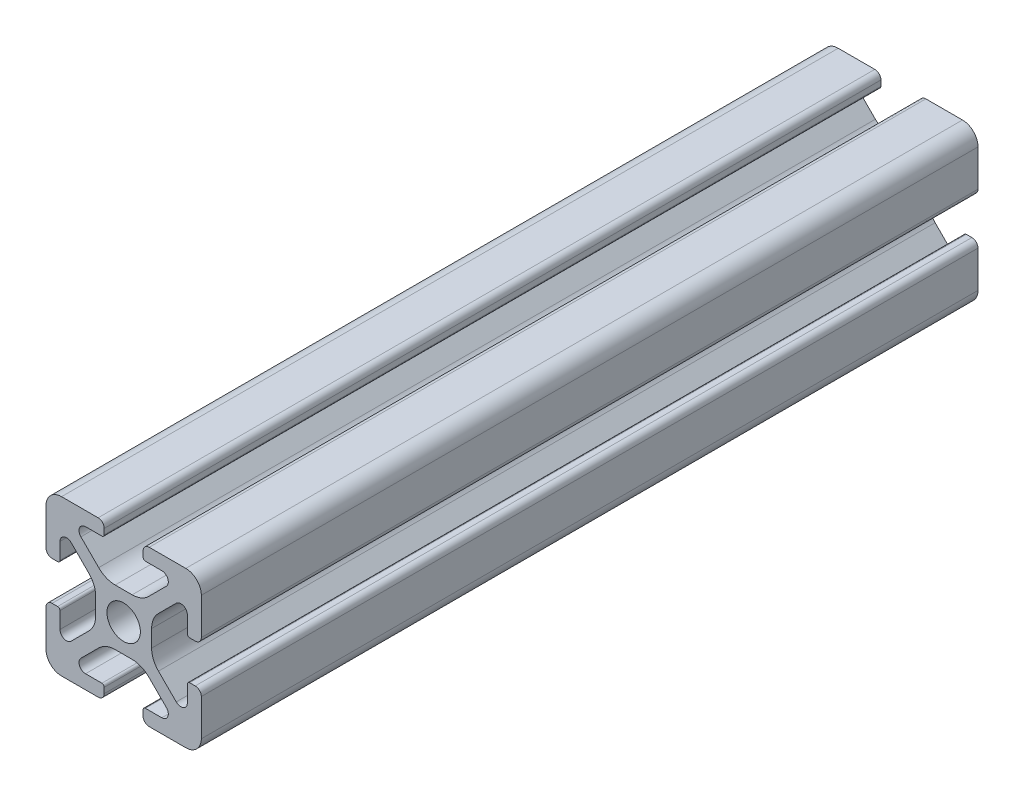
from build123d import *

# Parameters (mm, degrees)
BOSS_EXTRUDE1_DEPTH      = 50
BOSS_EXTRUDE1_DEPTH_BACK = 50
SKETCH3_R                = 2.15


with BuildPart() as part:
    # Sketch3 → Boss-Extrude1 (new, two sides: drawn at the far end of the back side and taken through both)
    with BuildSketch(Plane.XY.offset(-BOSS_EXTRUDE1_DEPTH_BACK)):
        with BuildLine():
            Line((8, 10), (3.2874, 10))
            ThreePointArc((3.2874, 10), (2.73062412, 9.76937588), (2.5, 9.2126))
            Line((2.5, 9.2126), (2.5, 8.5048))
            ThreePointArc((2.5, 8.5048), (2.589273853, 8.289273853), (2.8048, 8.2))
            Line((2.8048, 8.2), (4.9118, 8.2))
            ThreePointArc((4.9118, 8.2), (5.686195824, 7.682565253), (5.504496904, 6.769103096))
            Line((5.504496904, 6.769103096), (3.214073464, 4.478679656))
            ThreePointArc((3.214073464, 4.478679656), (2.240803418, 3.828361402), (1.092753121, 3.6))
            Line((1.092753121, 3.6), (-1.092753121, 3.6))
            ThreePointArc((-1.092753121, 3.6), (-2.240803418, 3.828361402), (-3.214073464, 4.478679656))
            Line((-3.214073464, 4.478679656), (-5.504496904, 6.769103096))
            ThreePointArc((-5.504496904, 6.769103096), (-5.686195824, 7.682565253), (-4.9118, 8.2))
            Line((-4.9118, 8.2), (-2.8048, 8.2))
            ThreePointArc((-2.8048, 8.2), (-2.589273853, 8.289273853), (-2.5, 8.5048))
            Line((-2.5, 8.5048), (-2.5, 9.2126))
            ThreePointArc((-2.5, 9.2126), (-2.73062412, 9.76937588), (-3.2874, 10))
            Line((-3.2874, 10), (-8, 10))
            ThreePointArc((-8, 10), (-9.414213562, 9.414213562), (-10, 8))
            Line((-10, 8), (-10, 3.2874))
            ThreePointArc((-10, 3.2874), (-9.76937588, 2.73062412), (-9.2126, 2.5))
            Line((-9.2126, 2.5), (-8.5048, 2.5))
            ThreePointArc((-8.5048, 2.5), (-8.289273853, 2.589273853), (-8.2, 2.8048))
            Line((-8.2, 2.8048), (-8.2, 4.9118))
            ThreePointArc((-8.2, 4.9118), (-7.682565253, 5.686195824), (-6.769103096, 5.504496904))
            Line((-6.769103096, 5.504496904), (-4.478679656, 3.214073464))
            ThreePointArc((-4.478679656, 3.214073464), (-3.828361402, 2.240803418), (-3.6, 1.092753121))
            Line((-3.6, 1.092753121), (-3.6, -1.092753121))
            ThreePointArc((-3.6, -1.092753121), (-3.828361402, -2.240803418), (-4.478679656, -3.214073464))
            Line((-4.478679656, -3.214073464), (-6.769103096, -5.504496904))
            ThreePointArc((-6.769103096, -5.504496904), (-7.682565253, -5.686195824), (-8.2, -4.9118))
            Line((-8.2, -4.9118), (-8.2, -2.8048))
            ThreePointArc((-8.2, -2.8048), (-8.289273853, -2.589273853), (-8.5048, -2.5))
            Line((-8.5048, -2.5), (-9.2126, -2.5))
            ThreePointArc((-9.2126, -2.5), (-9.76937588, -2.73062412), (-10, -3.2874))
            Line((-10, -3.2874), (-10, -8))
            ThreePointArc((-10, -8), (-9.414213562, -9.414213562), (-8, -10))
            Line((-8, -10), (-3.2874, -10))
            ThreePointArc((-3.2874, -10), (-2.73062412, -9.76937588), (-2.5, -9.2126))
            Line((-2.5, -9.2126), (-2.5, -8.5048))
            ThreePointArc((-2.5, -8.5048), (-2.589273853, -8.289273853), (-2.8048, -8.2))
            Line((-2.8048, -8.2), (-4.9118, -8.2))
            ThreePointArc((-4.9118, -8.2), (-5.686195824, -7.682565253), (-5.504496904, -6.769103096))
            Line((-5.504496904, -6.769103096), (-3.214073464, -4.478679656))
            ThreePointArc((-3.214073464, -4.478679656), (-2.240803418, -3.828361402), (-1.092753121, -3.6))
            Line((-1.092753121, -3.6), (1.092753121, -3.6))
            ThreePointArc((1.092753121, -3.6), (2.240803418, -3.828361402), (3.214073464, -4.478679656))
            Line((3.214073464, -4.478679656), (5.504496904, -6.769103096))
            ThreePointArc((5.504496904, -6.769103096), (5.686195824, -7.682565253), (4.9118, -8.2))
            Line((4.9118, -8.2), (2.8048, -8.2))
            ThreePointArc((2.8048, -8.2), (2.589273853, -8.289273853), (2.5, -8.5048))
            Line((2.5, -8.5048), (2.5, -9.2126))
            ThreePointArc((2.5, -9.2126), (2.73062412, -9.76937588), (3.2874, -10))
            Line((3.2874, -10), (8, -10))
            ThreePointArc((8, -10), (9.414213562, -9.414213562), (10, -8))
            Line((10, -8), (10, -3.2874))
            ThreePointArc((10, -3.2874), (9.76937588, -2.73062412), (9.2126, -2.5))
            Line((9.2126, -2.5), (8.5048, -2.5))
            ThreePointArc((8.5048, -2.5), (8.289273853, -2.589273853), (8.2, -2.8048))
            Line((8.2, -2.8048), (8.2, -4.9118))
            ThreePointArc((8.2, -4.9118), (7.682565253, -5.686195824), (6.769103096, -5.504496904))
            Line((6.769103096, -5.504496904), (4.478679656, -3.214073464))
            ThreePointArc((4.478679656, -3.214073464), (3.828361402, -2.240803418), (3.6, -1.092753121))
            Line((3.6, -1.092753121), (3.6, 1.092753121))
            ThreePointArc((3.6, 1.092753121), (3.828361402, 2.240803418), (4.478679656, 3.214073464))
            Line((4.478679656, 3.214073464), (6.769103096, 5.504496904))
            ThreePointArc((6.769103096, 5.504496904), (7.682565253, 5.686195824), (8.2, 4.9118))
            Line((8.2, 4.9118), (8.2, 2.8048))
            ThreePointArc((8.2, 2.8048), (8.289273853, 2.589273853), (8.5048, 2.5))
            Line((8.5048, 2.5), (9.2126, 2.5))
            ThreePointArc((9.2126, 2.5), (9.76937588, 2.73062412), (10, 3.2874))
            Line((10, 3.2874), (10, 8))
            ThreePointArc((10, 8), (9.414213562, 9.414213562), (8, 10))
        make_face()
        Circle(SKETCH3_R, mode=Mode.SUBTRACT)
    extrude(amount=BOSS_EXTRUDE1_DEPTH + BOSS_EXTRUDE1_DEPTH_BACK)


solid = part.part
